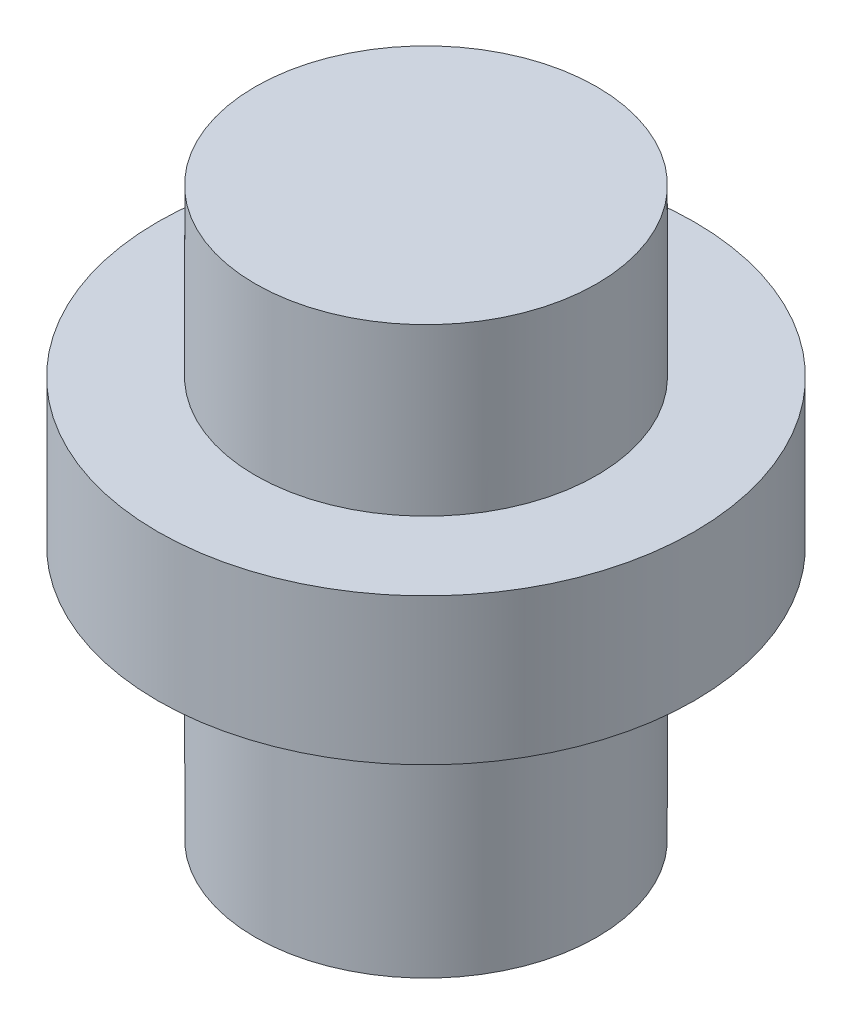
from build123d import *

# Parameters (mm, degrees)
SKETCH_1_R        = 1.75
EXTRUDE_1_DEPTH   = 5.8
SKETCH_2_R        = 2.75
SKETCH_2_R_2      = 1.75
EXTRUDE_1_2_DEPTH = 1.5


with BuildPart() as part:
    # 草图1 → Extrude 1 (new body)
    with BuildSketch(Plane.XZ.offset(8.55)):
        with Locations(Location((24.091410852, -9.546220913, 0), (0, 0, 270))):
            Circle(SKETCH_1_R)
    extrude(amount=EXTRUDE_1_DEPTH)

    # 草图2 → Extrude 1 2 (add)
    with BuildSketch(Plane(origin=(0, -10.25, 0), x_dir=(1, 0, 0), z_dir=(0, 1, 0))):
        with Locations((24.091410852, 9.546220913)):
            Circle(SKETCH_2_R)
        with Locations((24.091410852, 9.546220913)):
            Circle(SKETCH_2_R_2, mode=Mode.SUBTRACT)
    extrude(amount=-EXTRUDE_1_2_DEPTH)


solid = part.part
